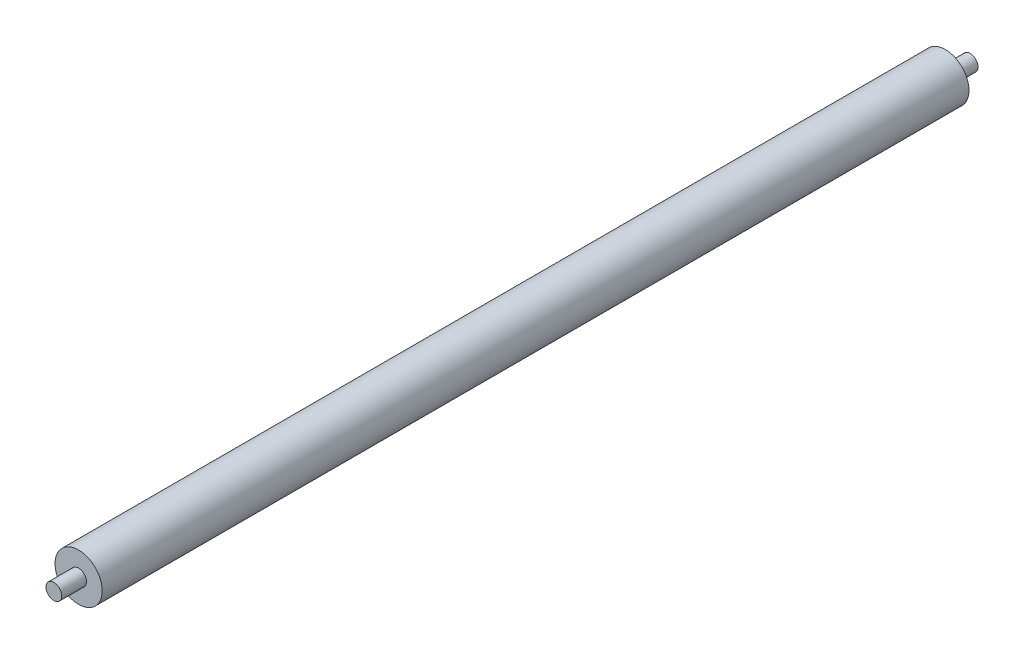
from build123d import *

# Parameters (mm, degrees)
SKETCH1_R           = 19.05
BOSS_EXTRUDE1_DEPTH = 350
SKETCH2_R           = 6.35
BOSS_EXTRUDE2_DEPTH = 370


with BuildPart() as part:
    # Sketch1 → Boss-Extrude1 (new, symmetric)
    with BuildSketch(Plane.XY):
        Circle(SKETCH1_R)
    extrude(amount=BOSS_EXTRUDE1_DEPTH, both=True)

    # Sketch2 → Boss-Extrude2 (add, symmetric)
    with BuildSketch(Plane.XY):
        Circle(SKETCH2_R)
    extrude(amount=BOSS_EXTRUDE2_DEPTH, both=True)


solid = part.part
